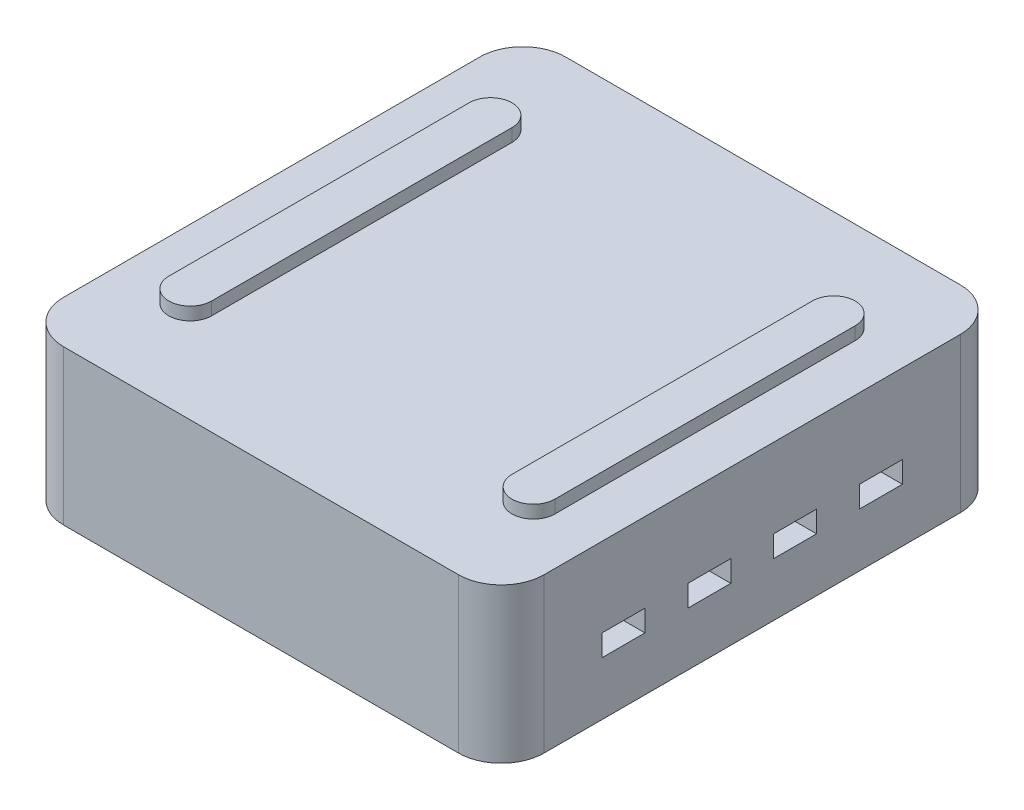
from build123d import *

# Parameters (mm, degrees)
SKETCH_1_W          = 112
SKETCH_1_H          = 117
EXTRUDE_1_DEPTH     = 36
FILLET_1_R          = 10
EXTRUDE_2_DEPTH     = 3
SKETCH_4_W          = 10
SKETCH_4_H          = 5
CUT_EXTRUDE_1_DEPTH = 10
FILLET_2_R          = 1
SKETCH_5_W          = 10
SKETCH_5_H          = 5
CUT_EXTRUDE_2_DEPTH = 10


with BuildPart() as part:
    # 草图1 → 凸台-拉伸1 (new body)
    with BuildSketch(Plane(origin=(0, 0, 0), x_dir=(1, 0, 0), z_dir=(0, 1, 0))):
        Rectangle(SKETCH_1_W, SKETCH_1_H)
    extrude(amount=EXTRUDE_1_DEPTH)

    # 圆角1
    fillet_1_edges = [part.edges().sort_by_distance(p)[0] for p in [
        (56, 18, 58.5),
        (-56, 18, 58.5),
        (-56, 18, -58.5),
        (56, 18, -58.5),
    ]]
    fillet(fillet_1_edges, radius=FILLET_1_R)

    # 草图3 → 凸台-拉伸2 (add)
    with BuildSketch(Plane(origin=(0, 36, 0), x_dir=(1, 0, 0), z_dir=(0, 1, 0))):
        with BuildLine():
            Line((-35, 35), (-35, -35))
            ThreePointArc((-35, -35), (-40, -40), (-45, -35))
            Line((-45, -35), (-45, 35))
            ThreePointArc((-45, 35), (-40, 40), (-35, 35))
        make_face()
        with BuildLine():
            Line((35, 35), (35, -35))
            ThreePointArc((35, -35), (40, -40), (45, -35))
            Line((45, -35), (45, 35))
            ThreePointArc((45, 35), (40, 40), (35, 35))
        make_face()
    extrude(amount=EXTRUDE_2_DEPTH)

    # 草图4 → 切除-拉伸1 (cut)
    with BuildSketch(Plane.ZY.offset(56)):
        with Locations((-10, 15)):
            Rectangle(SKETCH_4_W, SKETCH_4_H)
        with Locations((-30, 15)):
            Rectangle(SKETCH_4_W, SKETCH_4_H)
        with Locations((10, 15)):
            Rectangle(SKETCH_4_W, SKETCH_4_H)
        with Locations((30, 15)):
            Rectangle(SKETCH_4_W, SKETCH_4_H)
    extrude(amount=-CUT_EXTRUDE_1_DEPTH, mode=Mode.SUBTRACT)

    # 圆角2
    fillet_2_edges = [part.edges().sort_by_distance(p)[0] for p in [
        (-51, 12.5, -35),
        (-51, 17.5, -35),
        (-51, 17.5, -25),
        (-51, 12.5, -25),
        (-51, 17.5, -15),
        (-51, 17.5, -5),
        (-51, 12.5, -5),
        (-51, 12.5, -15),
        (-51, 17.5, 5),
        (-51, 17.5, 15),
        (-51, 12.5, 15),
        (-51, 12.5, 5),
        (-51, 17.5, 25),
        (-51, 17.5, 35),
        (-51, 12.5, 35),
        (-51, 12.5, 25),
    ]]
    fillet(fillet_2_edges, radius=FILLET_2_R)

    # 草图5 → 切除-拉伸2 (cut)
    with BuildSketch(Plane(origin=(56, 0, 0), x_dir=(0, 0, -1), z_dir=(1, 0, 0))):
        with Locations((-10, 15)):
            Rectangle(SKETCH_5_W, SKETCH_5_H)
        with Locations((-30, 15)):
            Rectangle(SKETCH_5_W, SKETCH_5_H)
        with Locations((10, 15)):
            Rectangle(SKETCH_5_W, SKETCH_5_H)
        with Locations((30, 15)):
            Rectangle(SKETCH_5_W, SKETCH_5_H)
    extrude(amount=-CUT_EXTRUDE_2_DEPTH, mode=Mode.SUBTRACT)


solid = part.part
